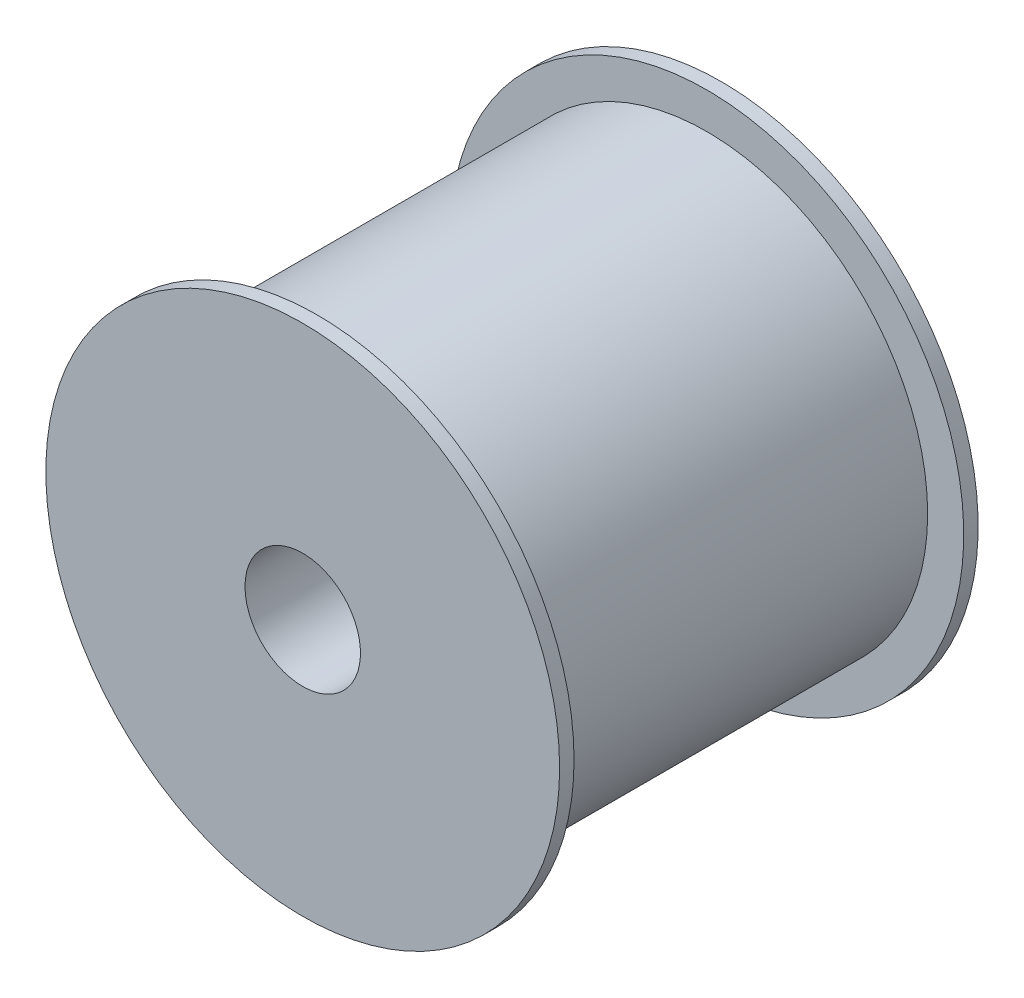
from build123d import *

# Parameters (mm, degrees)
SKETCH1_R           = 15.3
BOSS_EXTRUDE1_DEPTH = 27
SKETCH2_R           = 17.8
BOSS_EXTRUDE2_DEPTH = 1
BOSS_EXTRUDE4_START = 1
SKETCH6_R           = 17.8
BOSS_EXTRUDE4_DEPTH = 1
SKETCH7_R           = 4
CUT_EXTRUDE1_DEPTH  = 39.401562468


with BuildPart() as part:
    # Sketch1 → Boss-Extrude1 (new body)
    with BuildSketch(Plane.XY):
        Circle(SKETCH1_R)
    extrude(amount=BOSS_EXTRUDE1_DEPTH)

    # Sketch2 → Boss-Extrude2 (add)
    with BuildSketch(Plane.XY.offset(27)):
        Circle(SKETCH2_R)
    extrude(amount=BOSS_EXTRUDE2_DEPTH)

    # Sketch6 → Boss-Extrude4 (add)
    with BuildSketch(Plane(origin=(0, 0, 0), x_dir=(-1, 0, 0), z_dir=(0, 0, -1)).offset(BOSS_EXTRUDE4_START)):
        with Locations(Location((0, 0, 0), (0, 0, 180))):
            Circle(SKETCH6_R)
    extrude(amount=-BOSS_EXTRUDE4_DEPTH)

    # Sketch7 → Cut-Extrude1 (cut, through all)
    with BuildSketch(Plane(origin=(0, 0, -1), x_dir=(-1, 0, 0), z_dir=(0, 0, -1))):
        Circle(SKETCH7_R)
    extrude(amount=-CUT_EXTRUDE1_DEPTH, mode=Mode.SUBTRACT)


solid = part.part
